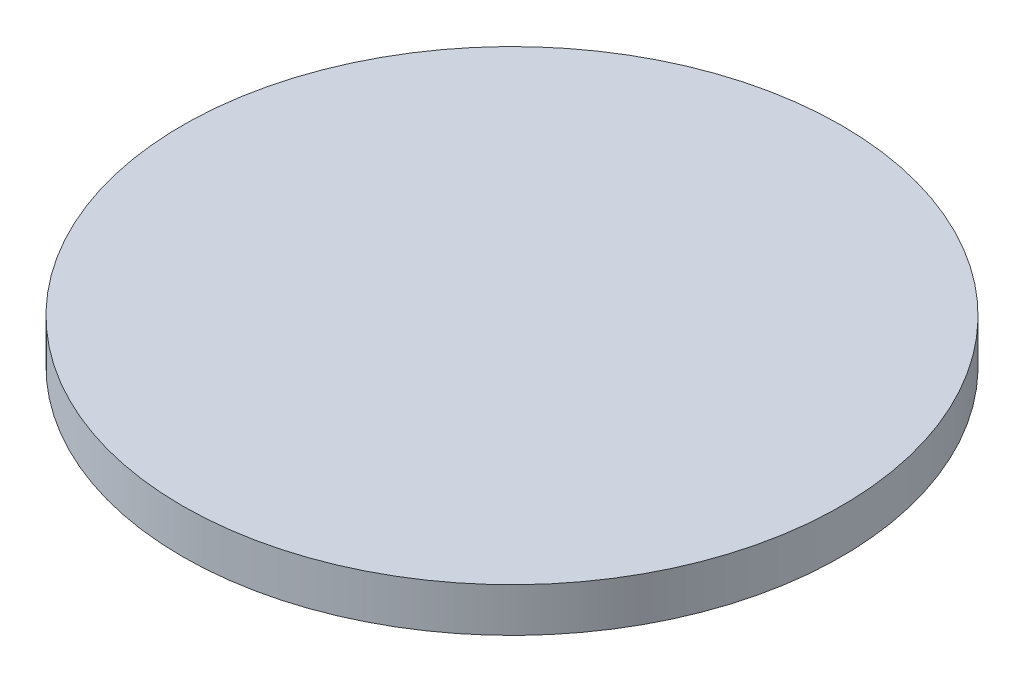
from build123d import *

# Parameters (mm, degrees)
KOLA330_BOYUN_DARALMA_D60_START = 108
SKETCH1_R                       = 30
KOLA330_BOYUN_DARALMA_D60_DEPTH = 4


with BuildPart() as part:
    # Sketch1 → KOLA330_boyun_daralma_D60 (new body)
    with BuildSketch(Plane(origin=(0, 0, 0), x_dir=(1, 0, 0), z_dir=(0, 1, 0)).offset(KOLA330_BOYUN_DARALMA_D60_START)):
        with Locations(Location((0, 0, 0), (0, 0, 270))):
            Circle(SKETCH1_R)
    extrude(amount=KOLA330_BOYUN_DARALMA_D60_DEPTH)


solid = part.part
